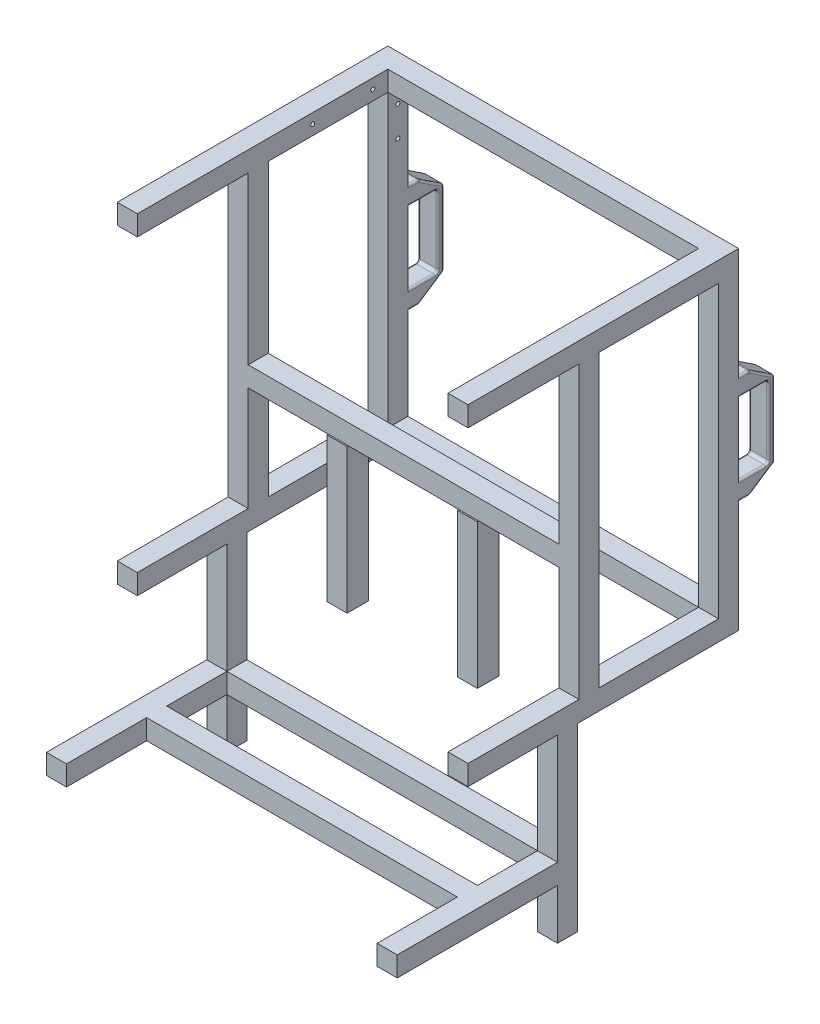
from build123d import *

# Parameters (mm, degrees)
SKETCH_1_W          = 350
SKETCH_1_H          = 330
SKETCH_1_W_2        = 310
SKETCH_1_H_2        = 290
EXTRUDE_1_DEPTH     = 20
SKETCH_2_W          = 20
SKETCH_2_H          = 20
EXTRUDE_2_DEPTH     = 250
EXTRUDE_3_DEPTH     = 20
EXTRUDE_START       = -20
EXTRUDE_4_DEPTH     = 20
FILLET_2_R          = 2
SKETCH_6_R          = 2
CUT_EXTRUDE_1_DEPTH = 20
SKETCH_7_W          = 20
SKETCH_7_H          = 20
EXTRUDE_5_DEPTH     = 180
EXTRUDE_6_REACH     = 541.166
SKETCH_8_W          = 20
SKETCH_8_H          = 20
SKETCH_9_W          = 20
SKETCH_9_H          = 20
EXTRUDE_7_DEPTH     = 160
EXTRUDE_8_REACH     = 579.8
SKETCH_10_W         = 20
SKETCH_10_H         = 20
EXTRUDE_9_REACH     = 580.492
SKETCH_12_W         = 20
SKETCH_12_H         = 20
EXTRUDE_10_REACH    = 579.8
SKETCH_13_W         = 20
SKETCH_13_H         = 20
SKETCH_14_W         = 20
SKETCH_14_H         = 21.329427543
EXTRUDE_11_DEPTH    = 144


with BuildPart() as part:
    # 草图1 → 凸台-拉伸1 (new body)
    with BuildSketch(Plane.XY):
        with Locations((175, 165)):
            Rectangle(SKETCH_1_W, SKETCH_1_H)
        with Locations((175, 165)):
            Rectangle(SKETCH_1_W_2, SKETCH_1_H_2, mode=Mode.SUBTRACT)
    extrude(amount=EXTRUDE_1_DEPTH)

    # 草图2 → 凸台-拉伸2 (add)
    with BuildSketch(Plane.XY.offset(20)):
        with Locations((10, 320)):
            Rectangle(SKETCH_2_W, SKETCH_2_H)
        with Locations((340, 320)):
            Rectangle(SKETCH_2_W, SKETCH_2_H)
        with Locations((10, 10)):
            Rectangle(SKETCH_2_W, SKETCH_2_H)
        with Locations((340, 10)):
            Rectangle(SKETCH_2_W, SKETCH_2_H)
    extrude(amount=EXTRUDE_2_DEPTH)

    # 草图4 → 凸台-拉伸3 (add)
    with BuildSketch(Plane.ZY):
        with BuildLine():
            Line((0, 219), (0, 201))
            Line((0, 201), (-27, 201))
            ThreePointArc((-27, 201), (-29.121320344, 200.121320344), (-30, 198))
            Line((-30, 198), (-30, 132))
            ThreePointArc((-30, 132), (-29.121320344, 129.878679656), (-27, 129))
            Line((-27, 129), (0, 129))
            Line((0, 129), (0, 111))
            Line((0, 111), (-10.0992488, 111))
            ThreePointArc((-10.0992488, 111), (-10.961952498, 111.126719239), (-11.751775425, 111.49617178))
            Line((-11.751775425, 111.49617178), (-34.652526625, 126.610667572))
            ThreePointArc((-34.652526625, 126.610667572), (-35.641739945, 127.692803117), (-36, 129.114495792))
            Line((-36, 129.114495792), (-36, 200.885504208))
            ThreePointArc((-36, 200.885504208), (-35.641739945, 202.307196883), (-34.652526625, 203.389332428))
            Line((-34.652526625, 203.389332428), (-11.751775425, 218.50382822))
            ThreePointArc((-11.751775425, 218.50382822), (-10.961952498, 218.873280761), (-10.0992488, 219))
            Line((-10.0992488, 219), (0, 219))
        make_face()
    extrude(amount=-EXTRUDE_3_DEPTH)

    # 草图5 → 凸台-拉伸4 (add)
    with BuildSketch(Plane(origin=(350, 0, 0), x_dir=(0, 0, -1), z_dir=(1, 0, 0)).offset(EXTRUDE_START)):
        with BuildLine():
            Line((30, 132), (30, 198))
            ThreePointArc((30, 198), (29.121320344, 200.121320344), (27, 201))
            Line((27, 201), (0, 201))
            Line((0, 201), (0, 219))
            Line((0, 219), (10.0992488, 219))
            ThreePointArc((10.0992488, 219), (10.961952498, 218.873280761), (11.751775425, 218.50382822))
            Line((11.751775425, 218.50382822), (34.652526625, 203.389332428))
            ThreePointArc((34.652526625, 203.389332428), (35.641739945, 202.307196883), (36, 200.885504208))
            Line((36, 200.885504208), (36, 129.114495792))
            ThreePointArc((36, 129.114495792), (35.641739945, 127.692803117), (34.652526625, 126.610667572))
            Line((34.652526625, 126.610667572), (11.751775425, 111.49617178))
            ThreePointArc((11.751775425, 111.49617178), (10.961952498, 111.126719239), (10.0992488, 111))
            Line((10.0992488, 111), (0, 111))
            Line((0, 111), (0, 129))
            Line((0, 129), (27, 129))
            ThreePointArc((27, 129), (29.121320344, 129.878679656), (30, 132))
        make_face()
    extrude(amount=EXTRUDE_4_DEPTH)

    # 圆角2
    fillet_2_edges = [part.edges().sort_by_distance(p)[0] for p in [
        (330, 218.873280761, -10.961952498),
        (330, 210.946580324, -23.202151025),
        (330, 202.307196883, -35.641739945),
        (330, 165, -36),
        (330, 127.692803117, -35.641739945),
        (330, 119.053419676, -23.202151025),
        (330, 111.126719239, -10.961952498),
        (330, 111, -5.0496244),
        (330, 129, -13.5),
        (330, 129.878679656, -29.121320344),
        (330, 165, -30),
        (330, 200.121320344, -29.121320344),
        (330, 201, -13.5),
        (330, 219, -5.0496244),
        (350, 218.873280761, -10.961952498),
        (350, 219, -5.0496244),
        (350, 201, -13.5),
        (350, 200.121320344, -29.121320344),
        (350, 165, -30),
        (350, 129.878679656, -29.121320344),
        (350, 129, -13.5),
        (350, 111, -5.0496244),
        (350, 111.126719239, -10.961952498),
        (350, 119.053419676, -23.202151025),
        (350, 127.692803117, -35.641739945),
        (350, 165, -36),
        (350, 202.307196883, -35.641739945),
        (350, 210.946580324, -23.202151025),
        (20, 219, -5.0496244),
        (20, 201, -13.5),
        (20, 200.121320344, -29.121320344),
        (20, 165, -30),
        (20, 129.878679656, -29.121320344),
        (20, 129, -13.5),
        (20, 111, -5.0496244),
        (20, 111.126719239, -10.961952498),
        (20, 119.053419676, -23.202151025),
        (20, 127.692803117, -35.641739945),
        (20, 165, -36),
        (20, 202.307196883, -35.641739945),
        (20, 210.946580324, -23.202151025),
        (20, 218.873280761, -10.961952498),
        (0, 219, -5.0496244),
        (0, 218.873280761, -10.961952498),
        (0, 210.946580324, -23.202151025),
        (0, 202.307196883, -35.641739945),
        (0, 165, -36),
        (0, 127.692803117, -35.641739945),
        (0, 119.053419676, -23.202151025),
        (0, 111.126719239, -10.961952498),
        (0, 111, -5.0496244),
        (0, 129, -13.5),
        (0, 129.878679656, -29.121320344),
        (0, 165, -30),
        (0, 200.121320344, -29.121320344),
        (0, 201, -13.5),
    ]]
    fillet(fillet_2_edges, radius=FILLET_2_R)

    # 草图6 → 切除-拉伸1 (cut)
    with BuildSketch(Plane.ZY):
        with Locations((10, 295)):
            Circle(SKETCH_6_R)
        with Locations((10, 265)):
            Circle(SKETCH_6_R)
        with Locations((35, 320)):
            Circle(SKETCH_6_R)
        with Locations((95, 320)):
            Circle(SKETCH_6_R)
    extrude(amount=-CUT_EXTRUDE_1_DEPTH, mode=Mode.SUBTRACT)

    # 草图7 → 凸台-拉伸5 (add)
    with BuildSketch(Plane.XZ):
        with Locations((340, 170.66541114)):
            Rectangle(SKETCH_7_W, SKETCH_7_H)
        with Locations((10, 170.66541114)):
            Rectangle(SKETCH_7_W, SKETCH_7_H)
    extrude(amount=EXTRUDE_5_DEPTH)

    # 草图8 → 凸台-拉伸6 (add, up to next)
    with BuildSketch(Plane.ZY.offset(-330), mode=Mode.PRIVATE) as extrude_6_sk1:
        with Locations((170.66541114, -120)):
            Rectangle(SKETCH_8_W, SKETCH_8_H)
    extrude_6_tool1 = extrude(extrude_6_sk1.sketch, amount=EXTRUDE_6_REACH, mode=Mode.PRIVATE) - part.part
    add(extrude_6_tool1.solids().sort_by_distance((330, -120, 170.665411))[0])

    # 草图9 → 凸台-拉伸7 (add)
    with BuildSketch(Plane.XY.offset(180.66541114)):
        with Locations((10, -120)):
            Rectangle(SKETCH_9_W, SKETCH_9_H)
        with Locations((340, -120)):
            Rectangle(SKETCH_9_W, SKETCH_9_H)
    extrude(amount=EXTRUDE_7_DEPTH)

    # 草图10 → 凸台-拉伸8 (add, up to next)
    with BuildSketch(Plane.ZY.offset(-330), mode=Mode.PRIVATE) as extrude_8_sk1:
        with Locations((250.66541114, -120)):
            Rectangle(SKETCH_10_W, SKETCH_10_H)
    extrude_8_tool1 = extrude(extrude_8_sk1.sketch, amount=EXTRUDE_8_REACH, mode=Mode.PRIVATE) - part.part
    add(extrude_8_tool1.solids().sort_by_distance((330, -120, 250.665411))[0])

    # 草图12 → 凸台-拉伸9 (add, up to next)
    with BuildSketch(Plane(origin=(0, 20, 0), x_dir=(1, 0, 0), z_dir=(0, 1, 0)), mode=Mode.PRIVATE) as extrude_9_sk1:
        with Locations((340, -149.335983597)):
            Rectangle(SKETCH_12_W, SKETCH_12_H)
    extrude_9_tool1 = extrude(extrude_9_sk1.sketch, amount=EXTRUDE_9_REACH, mode=Mode.PRIVATE) - part.part
    extrude_9 = extrude_9_tool1.solids().sort_by_distance((340, 20, 149.335984))[0]
    add(extrude_9)

    # 镜向1: 凸台-拉伸9 across plane
    add(extrude_9.mirror(Plane(origin=(175, 0, 0), x_dir=(0, 0, 1), z_dir=(1, 0, 0))))

    # 草图13 → 凸台-拉伸10 (add, up to next)
    with BuildSketch(Plane(origin=(20, 0, 0), x_dir=(0, 0, -1), z_dir=(1, 0, 0)), mode=Mode.PRIVATE) as extrude_10_sk1:
        with Locations((-149.335983597, 134.199314392)):
            Rectangle(SKETCH_13_W, SKETCH_13_H)
    extrude_10_tool1 = extrude(extrude_10_sk1.sketch, amount=EXTRUDE_10_REACH, mode=Mode.PRIVATE) - part.part
    add(extrude_10_tool1.solids().sort_by_distance((20, 134.199314, 149.335984))[0])

    # 草图14 → 凸台-拉伸11 (add)
    with BuildSketch(Plane.XZ.offset(-124.199314392)):
        with Locations((240, 150.000697368)):
            Rectangle(SKETCH_14_W, SKETCH_14_H)
        with Locations((110, 150.000697368)):
            Rectangle(SKETCH_14_W, SKETCH_14_H)
    extrude(amount=EXTRUDE_11_DEPTH)


solid = part.part
